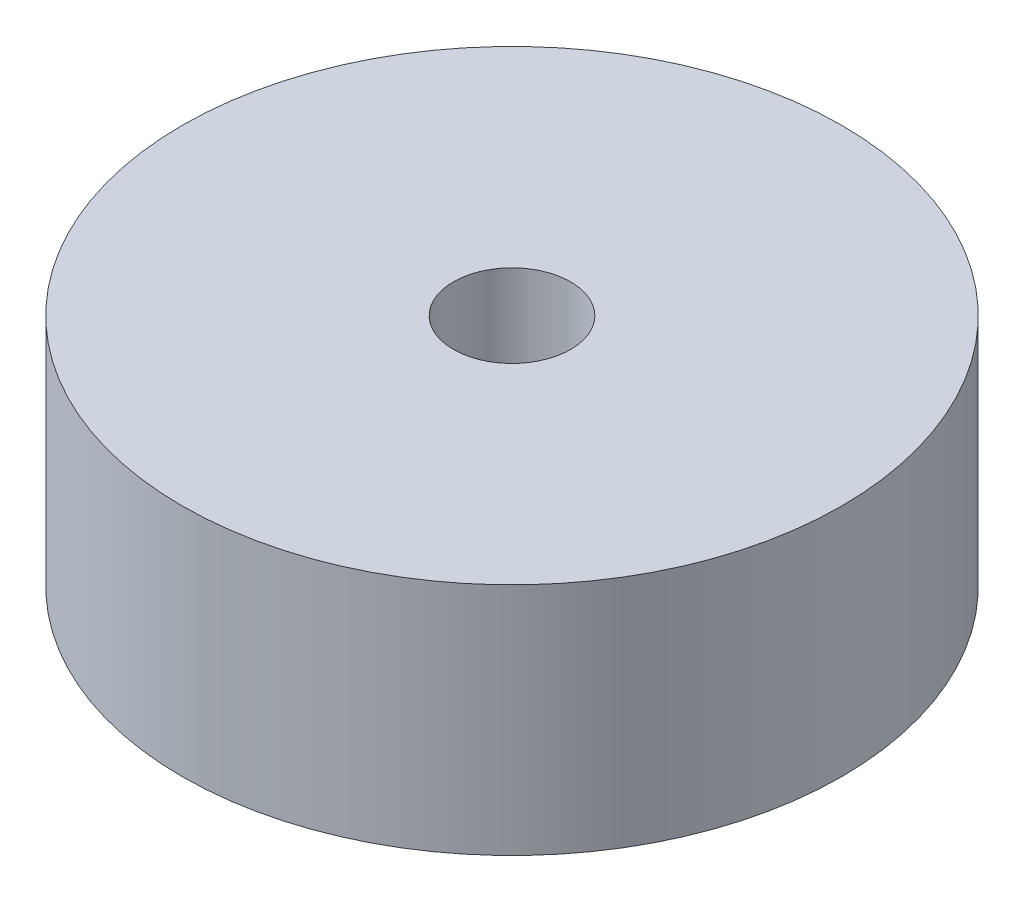
from build123d import *

# Parameters (mm, degrees)
SKETCH1_R           = 22.5
SKETCH1_R_2         = 4
BOSS_EXTRUDE1_DEPTH = 16


with BuildPart() as part:
    # Sketch1 → Boss-Extrude1 (new body)
    with BuildSketch(Plane(origin=(0, 0, 0), x_dir=(1, 0, 0), z_dir=(0, 1, 0))):
        with Locations(Location((0, 0, 0), (0, 0, 270))):
            Circle(SKETCH1_R)
        with Locations(Location((0, 0, 0), (0, 0, 270))):
            Circle(SKETCH1_R_2, mode=Mode.SUBTRACT)
    extrude(amount=BOSS_EXTRUDE1_DEPTH)


solid = part.part
